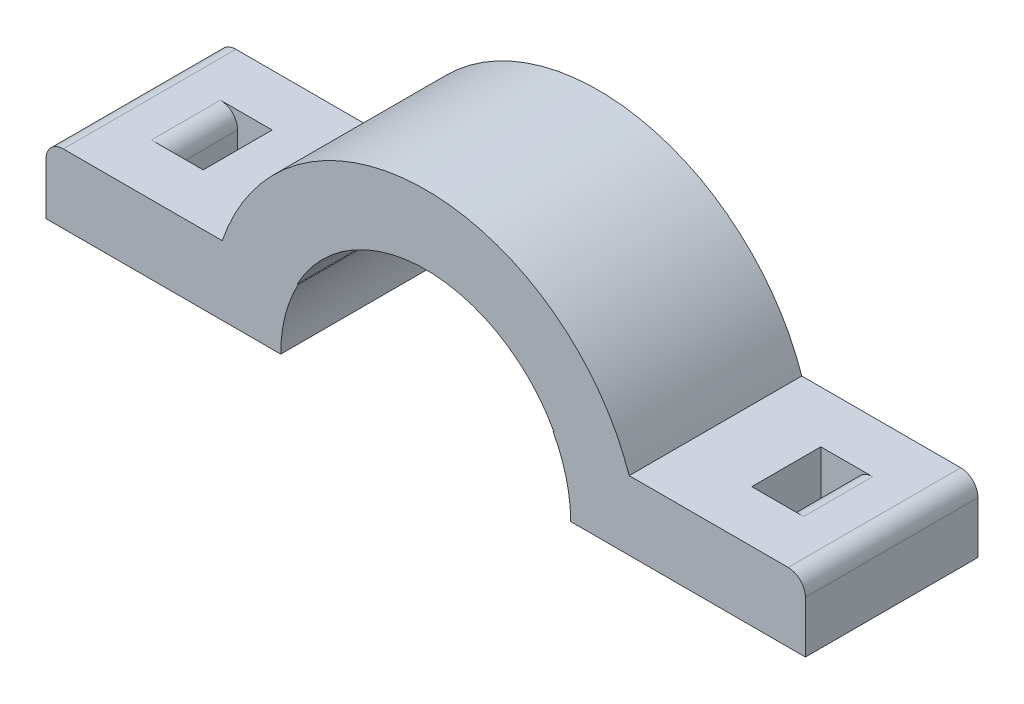
from build123d import *

# Parameters (mm, degrees)
BOSS_EXTRUDE1_DEPTH = 12.7
SKETCH3_W           = 12.7
SKETCH3_H           = 5.08
BOSS_EXTRUDE2_DEPTH = 27.94
SKETCH4_R           = 10.668
CUT_EXTRUDE1_DEPTH  = 44.196
CUT_EXTRUDE3_REACH  = 36.524
SKETCH6_W           = 2.54
SKETCH6_H           = 5.08
FILLET1_R           = 1.27


with BuildPart() as part:
    # Sketch2 → Boss-Extrude1 (new body)
    with BuildSketch(Plane.XY):
        with BuildLine():
            Line((-15.8115, 0), (-10.7315, 0))
            ThreePointArc((-10.7315, 0), (0, 10.7315), (10.7315, 0))
            Line((10.7315, 0), (15.8115, 0))
            ThreePointArc((15.8115, 0), (0, 15.8115), (-15.8115, 0))
        make_face()
    extrude(amount=BOSS_EXTRUDE1_DEPTH)

    # Sketch3 → Boss-Extrude2 (add, symmetric)
    with BuildSketch(Plane(origin=(0, 0, 0), x_dir=(0, 0, -1), z_dir=(1, 0, 0))):
        with Locations((-6.35, 2.54)):
            Rectangle(SKETCH3_W, SKETCH3_H)
    extrude(amount=BOSS_EXTRUDE2_DEPTH, both=True)

    # Sketch4 → Cut-Extrude1 (cut)
    with BuildSketch(Plane.XY.offset(12.7)):
        Circle(SKETCH4_R)
    extrude(amount=-CUT_EXTRUDE1_DEPTH, mode=Mode.SUBTRACT)

    # Sketch6 → Cut-Extrude3 (cut, up to next)
    with BuildSketch(Plane.XZ, mode=Mode.PRIVATE) as cut_extrude3_sk1:
        with Locations((-21.456606913, 6.35)):
            Rectangle(SKETCH6_W, SKETCH6_H)
    cut_extrude3_tool1 = extrude(cut_extrude3_sk1.sketch, amount=-CUT_EXTRUDE3_REACH, mode=Mode.PRIVATE) & part.part
    # Sketch6 → Cut-Extrude3 (cut, up to next)
    with BuildSketch(Plane.XZ, mode=Mode.PRIVATE) as cut_extrude3_sk2:
        with Locations((21.456606913, 6.35)):
            Rectangle(SKETCH6_W, SKETCH6_H)
    cut_extrude3_tool2 = extrude(cut_extrude3_sk2.sketch, amount=-CUT_EXTRUDE3_REACH, mode=Mode.PRIVATE) & part.part
    add(cut_extrude3_tool1.solids().sort_by_distance((-21.456607, 0, 6.35))[0], mode=Mode.SUBTRACT)
    add(cut_extrude3_tool2.solids().sort_by_distance((21.456607, 0, 6.35))[0], mode=Mode.SUBTRACT)

    # Fillet1
    fillet1_edges = [part.edges().sort_by_distance(p)[0] for p in [
        (-27.94, 5.08, 6.35),
        (27.94, 5.08, 6.35),
        (-22.726606913, 5.08, 6.35),
        (22.726606913, 5.08, 6.35),
    ]]
    fillet(fillet1_edges, radius=FILLET1_R)


solid = part.part
